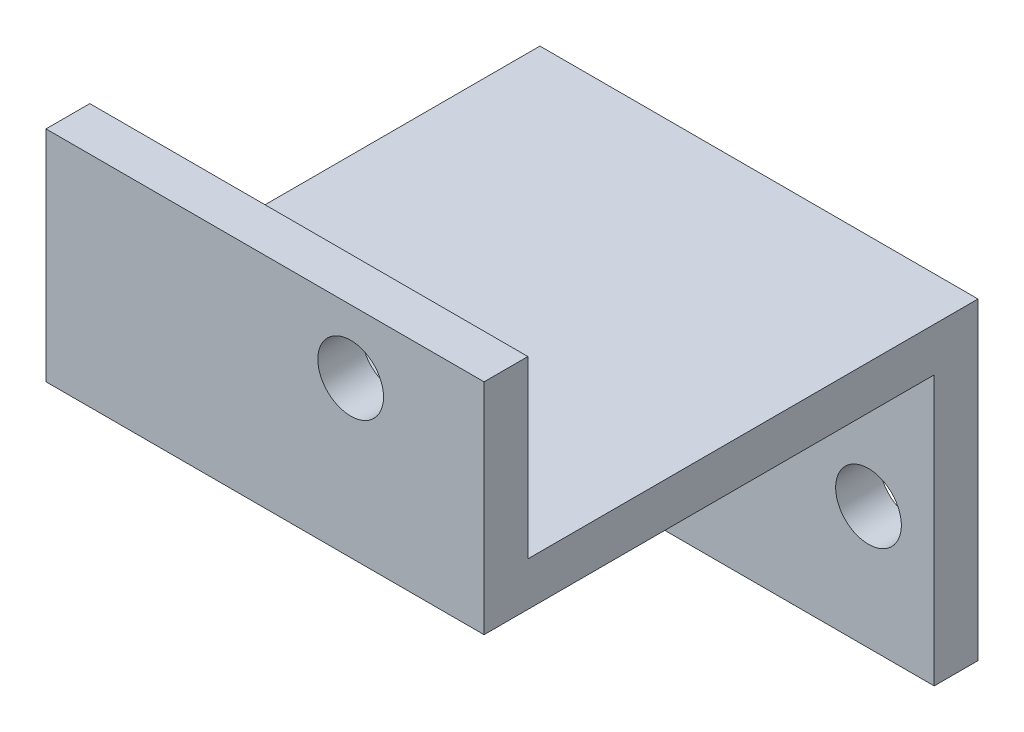
from build123d import *

# Parameters (mm, degrees)
ESQUISSE1_W             = 20
ESQUISSE1_H             = 14.3
BOSS_EXTRU_1_DEPTH      = 2
ESQUISSE2_W             = 20
ESQUISSE2_H             = 2
BOSS_EXTRU_2_DEPTH      = 20.55
ESQUISSE3_W             = 20
ESQUISSE3_H             = 2
BOSS_EXTRU_3_DEPTH      = 8
ESQUISSE4_R             = 1.5
ENL_V_MAT_EXTRU_2_DEPTH = 8
ESQUISSE5_R             = 1.5
ENL_V_MAT_EXTRU_3_DEPTH = 8


with BuildPart() as part:
    # Esquisse1 → Boss.-Extru.1 (new body)
    with BuildSketch(Plane.XY):
        with Locations((10, 7.15)):
            Rectangle(ESQUISSE1_W, ESQUISSE1_H)
    extrude(amount=BOSS_EXTRU_1_DEPTH)

    # Esquisse2 → Boss.-Extru.2 (add)
    with BuildSketch(Plane.XY.offset(2)):
        with Locations((10, 13.3)):
            Rectangle(ESQUISSE2_W, ESQUISSE2_H)
    extrude(amount=BOSS_EXTRU_2_DEPTH)

    # Esquisse3 → Boss.-Extru.3 (add)
    with BuildSketch(Plane(origin=(0, 14.3, 0), x_dir=(1, 0, 0), z_dir=(0, 1, 0))):
        with Locations((10, -21.55)):
            Rectangle(ESQUISSE3_W, ESQUISSE3_H)
    extrude(amount=BOSS_EXTRU_3_DEPTH)

    # Esquisse4 → Enlèv. mat.-Extru.2 (cut)
    with BuildSketch(Plane(origin=(0, 0, 0), x_dir=(-1, 0, 0), z_dir=(0, 0, -1))):
        with Locations((-17, 5.6)):
            Circle(ESQUISSE4_R)
        with Locations((-3, 5.6)):
            Circle(ESQUISSE4_R)
    extrude(amount=-ENL_V_MAT_EXTRU_2_DEPTH, mode=Mode.SUBTRACT)

    # Esquisse5 → Enlèv. mat.-Extru.3 (cut)
    with BuildSketch(Plane.XY.offset(22.55)):
        with Locations((13.91, 19.4)):
            Circle(ESQUISSE5_R)
    extrude(amount=-ENL_V_MAT_EXTRU_3_DEPTH, mode=Mode.SUBTRACT)


solid = part.part
